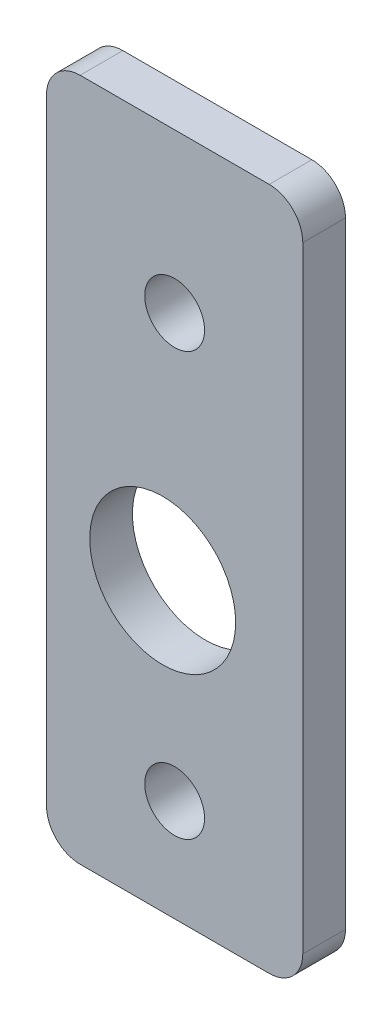
from build123d import *

# Parameters (mm, degrees)
SKETCH1_W           = 38.1
SKETCH1_H           = 101.6
SKETCH1_R           = 10.85
BOSS_EXTRUDE1_DEPTH = 6.35
FILLET1_R           = 5
FILLET2_R           = 5
FILLET3_R           = 5
FILLET4_R           = 5
CUT_EXTRUDE1_REACH  = 180.93
SKETCH2_R           = 4.445


with BuildPart() as part:
    # Sketch1 → Boss-Extrude1 (new body)
    with BuildSketch(Plane.XY):
        with Locations((0, -127)):
            Rectangle(SKETCH1_W, SKETCH1_H)
        with Locations((-1.778, -135.128)):
            Circle(SKETCH1_R, mode=Mode.SUBTRACT)
    extrude(amount=BOSS_EXTRUDE1_DEPTH)

    # Fillet1
    fillet1_edges = [part.edges().sort_by_distance(p)[0] for p in [
        (-19.05, -76.2, 3.175),
    ]]
    fillet(fillet1_edges, radius=FILLET1_R)

    # Fillet2
    fillet2_edges = [part.edges().sort_by_distance(p)[0] for p in [
        (19.05, -76.2, 3.175),
    ]]
    fillet(fillet2_edges, radius=FILLET2_R)

    # Fillet3
    fillet3_edges = [part.edges().sort_by_distance(p)[0] for p in [
        (19.05, -177.8, 3.175),
    ]]
    fillet(fillet3_edges, radius=FILLET3_R)

    # Fillet4
    fillet4_edges = [part.edges().sort_by_distance(p)[0] for p in [
        (-19.05, -177.8, 3.175),
    ]]
    fillet(fillet4_edges, radius=FILLET4_R)

    # Sketch2 → Cut-Extrude1 (cut, up to next)
    with BuildSketch(Plane.XY.offset(6.35), mode=Mode.PRIVATE) as cut_extrude1_sk1:
        with Locations((0, -99.788381621)):
            Circle(SKETCH2_R)
    cut_extrude1_tool1 = extrude(cut_extrude1_sk1.sketch, amount=-CUT_EXTRUDE1_REACH, mode=Mode.PRIVATE) & part.part
    # Sketch2 → Cut-Extrude1 (cut, up to next)
    with BuildSketch(Plane.XY.offset(6.35), mode=Mode.PRIVATE) as cut_extrude1_sk2:
        with Locations((0, -162.625541616)):
            Circle(SKETCH2_R)
    cut_extrude1_tool2 = extrude(cut_extrude1_sk2.sketch, amount=-CUT_EXTRUDE1_REACH, mode=Mode.PRIVATE) & part.part
    add(cut_extrude1_tool1.solids().sort_by_distance((0, -99.788382, 6.35))[0], mode=Mode.SUBTRACT)
    add(cut_extrude1_tool2.solids().sort_by_distance((0, -162.625542, 6.35))[0], mode=Mode.SUBTRACT)


solid = part.part
